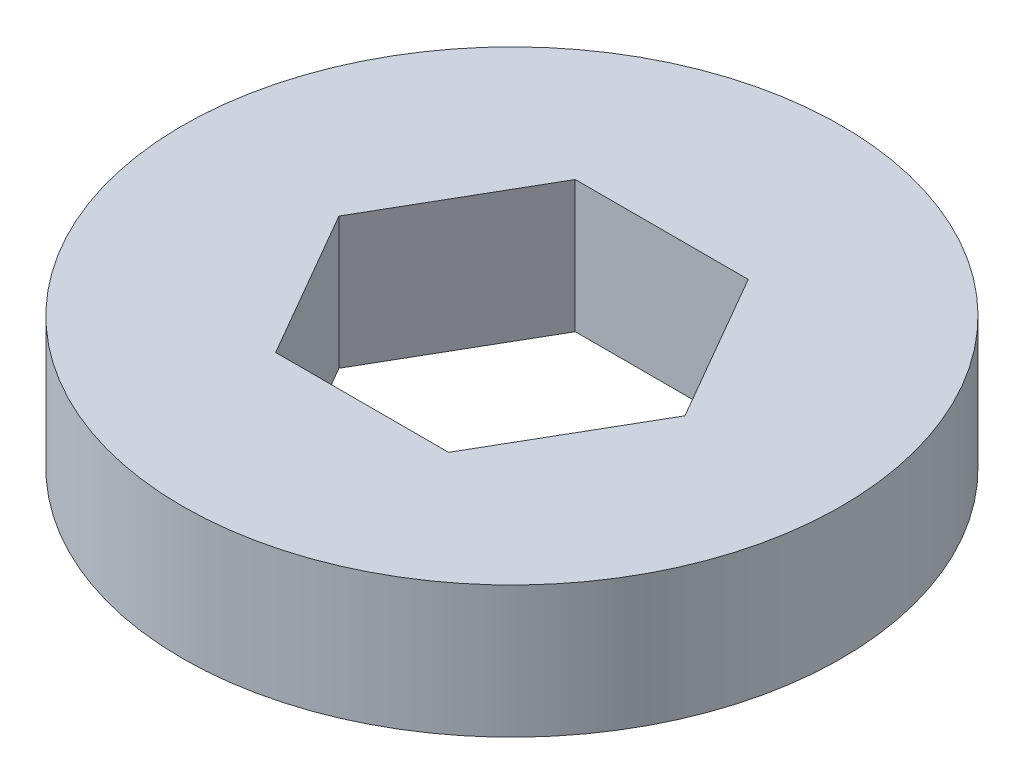
from build123d import *

# Parameters (mm, degrees)
SKETCH1_R           = 13.97
BOSS_EXTRUDE1_DEPTH = 5.588


with BuildPart() as part:
    # Sketch1 → Boss-Extrude1 (new body)
    with BuildSketch(Plane(origin=(0, 0, 0), x_dir=(1, 0, 0), z_dir=(0, 1, 0))):
        with Locations(Location((0, 0, 0), (0, 0, 270))):
            Circle(SKETCH1_R)
        Polygon((7.332348419, 0), (3.666174209, 6.35), (-3.666174209, 6.35), (-7.332348419, 0), (-3.666174209, -6.35), (3.666174209, -6.35), align=None, mode=Mode.SUBTRACT)
    extrude(amount=BOSS_EXTRUDE1_DEPTH)


solid = part.part
